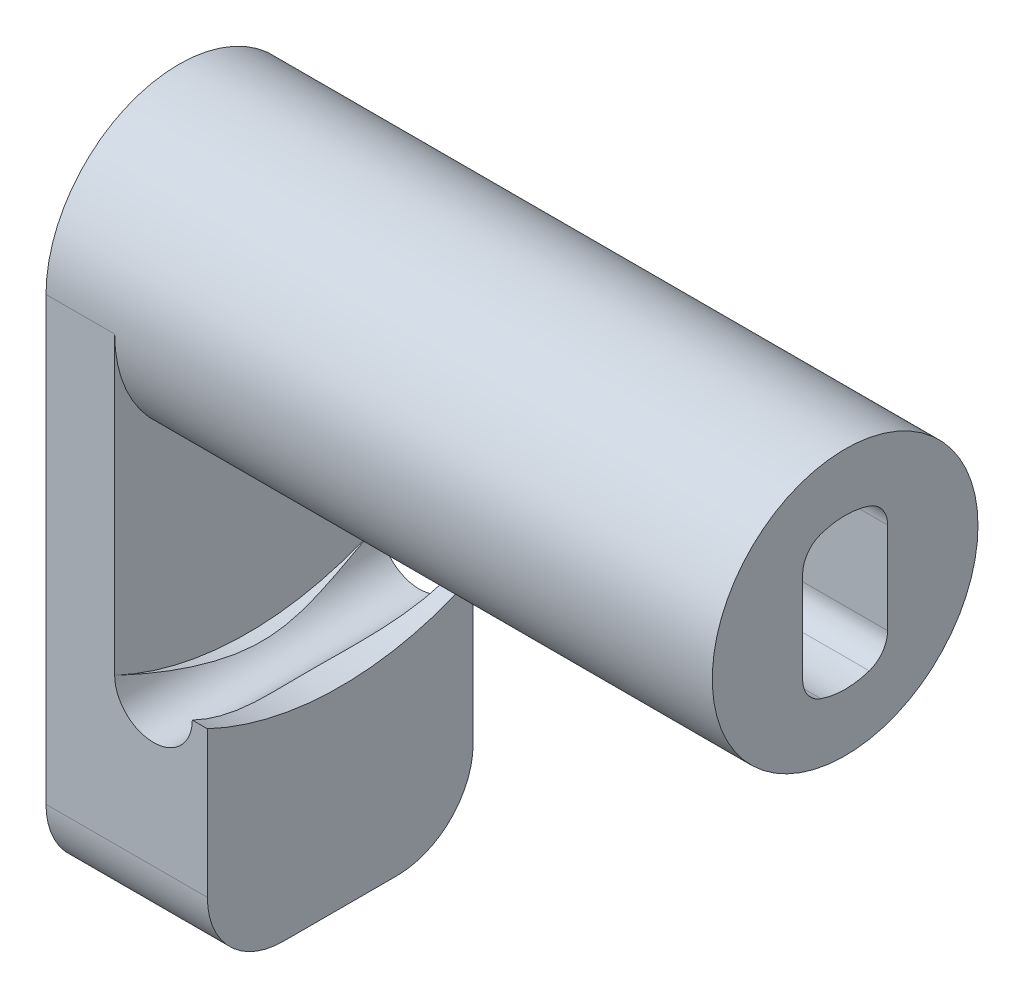
from build123d import *

# Parameters (mm, degrees)
SKETCH1_R           = 8.7376
BOSS_EXTRUDE1_DEPTH = 43.815
BOSS_EXTRUDE3_DEPTH = 4.516000112
FILLET2_R           = 5
BOSS_EXTRUDE4_START = 6.096
BOSS_EXTRUDE4_DEPTH = 6.096
CUT_EXTRUDE8_DEPTH  = 6.096
CUT_EXTRUDE10_DEPTH = 12.192
FILLET11_R          = 1.778
SKETCH25_R          = 2.5527
CUT_EXTRUDE14_DEPTH = 59.168600946
CUT_EXTRUDE15_DEPTH = 21.59
FILLET12_R          = 1.5875


with BuildPart() as part:
    # Sketch1 → Boss-Extrude1 (new body)
    with BuildSketch(Plane.YZ):
        with Locations(Location((0, 0, 0), (0, 0, 270))):
            Circle(SKETCH1_R)
    extrude(amount=BOSS_EXTRUDE1_DEPTH)

    # Sketch10 → Boss-Extrude3 (add)
    with BuildSketch(Plane(origin=(0, 0, 0), x_dir=(0, -1, 0), z_dir=(-1, 0, 0))):
        with BuildLine():
            Line((0, 8.7376), (34.036, 8.7376))
            Line((34.036, 8.7376), (34.036, -8.7376))
            Line((34.036, -8.7376), (0, -8.7376))
            ThreePointArc((0, -8.7376), (8.7376, 0), (0, 8.7376))
        make_face()
    extrude(amount=-BOSS_EXTRUDE3_DEPTH)

    # Fillet2
    fillet2_edges = [part.edges().sort_by_distance(p)[0] for p in [
        (2.258000056, -34.036, 8.7376),
        (2.258000056, -34.036, -8.7376),
    ]]
    fillet(fillet2_edges, radius=FILLET2_R)

    # Sketch15 → Boss-Extrude4 (add)
    with BuildSketch(Plane.YZ.offset(4.516000112).offset(BOSS_EXTRUDE4_START)):
        with BuildLine():
            Line((-18.796, 8.7376), (-29.036, 8.7376))
            ThreePointArc((-29.036, 8.7376), (-32.571533906, 7.273133906), (-34.036, 3.7376))
            Line((-34.036, 3.7376), (-34.036, -3.7376))
            ThreePointArc((-34.036, -3.7376), (-32.571533906, -7.273133906), (-29.036, -8.7376))
            Line((-29.036, -8.7376), (-18.796, -8.7376))
            Line((-18.796, -8.7376), (-18.796, 8.7376))
        make_face()
    extrude(amount=-BOSS_EXTRUDE4_DEPTH)

    # Sketch21 → Cut-Extrude8 (cut)
    with BuildSketch(Plane.YZ.offset(10.612000112)):
        with BuildLine():
            Line((-19.431, -8.7376), (-18.796, -8.7376))
            Line((-18.796, -8.7376), (-18.796, 8.7376))
            Line((-18.796, 8.7376), (-19.431, 8.7376))
            ThreePointArc((-19.431, 8.7376), (-21.405517007, 0), (-19.431, -8.7376))
        make_face()
    extrude(amount=-CUT_EXTRUDE8_DEPTH, mode=Mode.SUBTRACT)

    # Sketch22 → Cut-Extrude10 (cut)
    with BuildSketch(Plane.YZ.offset(43.815)):
        with BuildLine():
            Line((-4.089715516, -2.794), (4.089715516, -2.794))
            ThreePointArc((4.089715516, -2.794), (4.953, 0), (4.089715516, 2.794))
            Line((4.089715516, 2.794), (-4.089715516, 2.794))
            ThreePointArc((-4.089715516, 2.794), (-4.953, 0), (-4.089715516, -2.794))
        make_face()
    extrude(amount=-CUT_EXTRUDE10_DEPTH, mode=Mode.SUBTRACT)

    # Fillet11
    fillet11_edges = [part.edges().sort_by_distance(p)[0] for p in [
        (37.719, 4.089715516, 2.794),
        (37.719, 4.089715516, -2.794),
        (37.719, -4.089715516, -2.794),
        (37.719, -4.089715516, 2.794),
    ]]
    fillet(fillet11_edges, radius=FILLET11_R)

    # Sketch25 → Cut-Extrude14 (cut, through all)
    with BuildSketch(Plane(origin=(0, 0, -8.7376), x_dir=(1, 0, 0), z_dir=(0, 0, -1))):
        with Locations((7.068700112, 19.431)):
            Circle(SKETCH25_R)
    extrude(amount=-CUT_EXTRUDE14_DEPTH, mode=Mode.SUBTRACT)

    # Sketch26 → Cut-Extrude15 (cut)
    with BuildSketch(Plane(origin=(0, 0, 0), x_dir=(0, -1, 0), z_dir=(-1, 0, 0))):
        with BuildLine():
            Line((3.684641875, 1.7145), (7.177141875, 1.7145))
            Line((7.177141875, 1.7145), (7.177141875, -1.7145))
            Line((7.177141875, -1.7145), (3.684641875, -1.7145))
            ThreePointArc((3.684641875, -1.7145), (-4.064, 0), (3.684641875, 1.7145))
        make_face()
    extrude(amount=-CUT_EXTRUDE15_DEPTH, mode=Mode.SUBTRACT)

    # Fillet12
    fillet12_edges = [part.edges().sort_by_distance(p)[0] for p in [
        (10.795, -3.684641875, -1.7145),
        (10.795, -3.684641875, 1.7145),
        (10.795, -7.177141875, 1.7145),
        (10.795, -7.177141875, -1.7145),
    ]]
    fillet(fillet12_edges, radius=FILLET12_R)


solid = part.part
